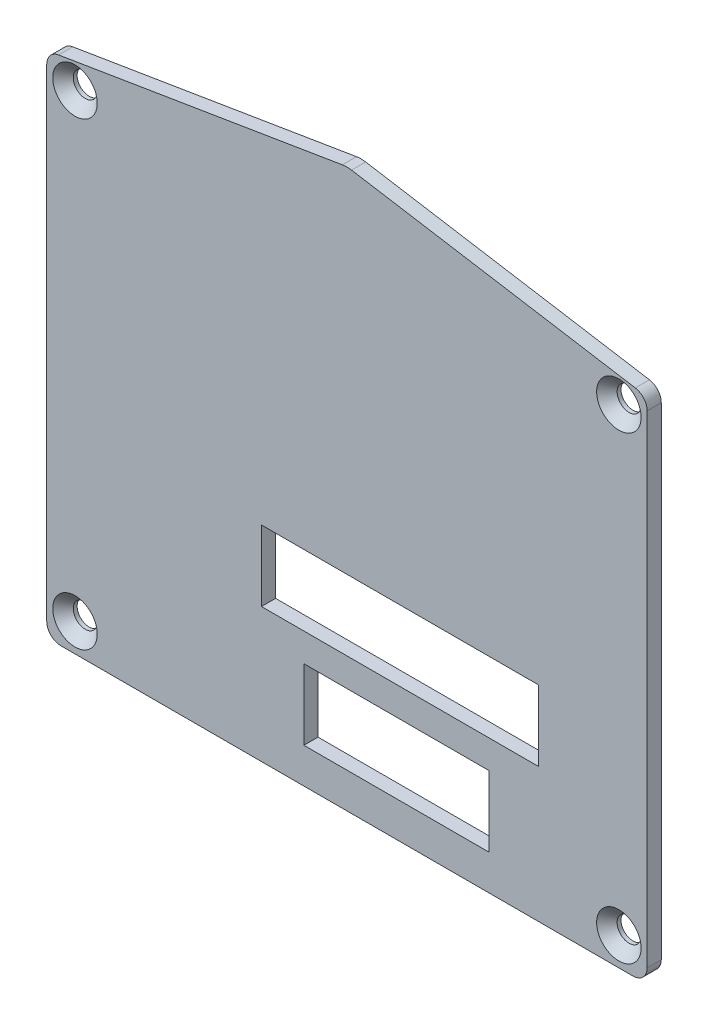
from build123d import *

# Parameters (mm, degrees)
SCHIZZO1_W                            = 85
SCHIZZO1_H                            = 72
ESTRUSIONE_ESTRUSIONE1_DEPTH          = 2
RACCORDO1_R                           = 4
RACCORDO3_R                           = 2
RACCORDO4_R                           = 2
RACCORDO5_R                           = 2
RACCORDO6_R                           = 2
TAGLIO_ESTRUSIONE1_REACH              = 62.453
SCHIZZO2_W                            = 39.2
SCHIZZO2_H                            = 10
SCHIZZO2_W_2                          = 26.2
FORO_SVASATO_PER_VITE_M3_1_AT_2_COUNT = 2
FORO_SVASATO_PER_VITE_M3_1_AT_2_PITCH = 65.075876997
FORO_SVASATO_PER_VITE_M3_1_AT_3_COUNT = 2
FORO_SVASATO_PER_VITE_M3_1_AT_3_PITCH = 100.816019396
FORO_SVASATO_PER_VITE_M3_1_AT_4_COUNT = 2
FORO_SVASATO_PER_VITE_M3_1_AT_4_PITCH = 77


with BuildPart() as part:
    # Schizzo1 → Estrusione-Estrusione1 (new body)
    with BuildSketch(Plane.XY):
        Rectangle(SCHIZZO1_W, SCHIZZO1_H)
        Polygon((0, 43), (42.5, 36), (-42.5, 36), align=None)
    extrude(amount=ESTRUSIONE_ESTRUSIONE1_DEPTH)

    # Raccordo1
    raccordo1_edges = [part.edges().sort_by_distance(p)[0] for p in [
        (0, 43, 1),
    ]]
    fillet(raccordo1_edges, radius=RACCORDO1_R)

    # Raccordo3
    raccordo3_edges = [part.edges().sort_by_distance(p)[0] for p in [
        (42.5, 36, 1),
    ]]
    fillet(raccordo3_edges, radius=RACCORDO3_R)

    # Raccordo4
    raccordo4_edges = [part.edges().sort_by_distance(p)[0] for p in [
        (42.5, -36, 1),
    ]]
    fillet(raccordo4_edges, radius=RACCORDO4_R)

    # Raccordo5
    raccordo5_edges = [part.edges().sort_by_distance(p)[0] for p in [
        (-42.5, -36, 1),
    ]]
    fillet(raccordo5_edges, radius=RACCORDO5_R)

    # Raccordo6
    raccordo6_edges = [part.edges().sort_by_distance(p)[0] for p in [
        (-42.5, 36, 1),
    ]]
    fillet(raccordo6_edges, radius=RACCORDO6_R)

    # Schizzo2 → Taglio-Estrusione1 (cut, up to next)
    with BuildSketch(Plane.XY.offset(2), mode=Mode.PRIVATE) as taglio_estrusione1_sk1:
        with Locations((7.5, -11.99)):
            Rectangle(SCHIZZO2_W, SCHIZZO2_H)
    taglio_estrusione1_tool1 = extrude(taglio_estrusione1_sk1.sketch, amount=-TAGLIO_ESTRUSIONE1_REACH, mode=Mode.PRIVATE) & part.part
    # Schizzo2 → Taglio-Estrusione1 (cut, up to next)
    with BuildSketch(Plane.XY.offset(2), mode=Mode.PRIVATE) as taglio_estrusione1_sk2:
        with Locations((7, -26)):
            Rectangle(SCHIZZO2_W_2, SCHIZZO2_H)
    taglio_estrusione1_tool2 = extrude(taglio_estrusione1_sk2.sketch, amount=-TAGLIO_ESTRUSIONE1_REACH, mode=Mode.PRIVATE) & part.part
    add(taglio_estrusione1_tool1.solids().sort_by_distance((7.5, -11.99, 2))[0], mode=Mode.SUBTRACT)
    add(taglio_estrusione1_tool2.solids().sort_by_distance((7, -26, 2))[0], mode=Mode.SUBTRACT)

    # Schizzo4 → Foro svasato per Vite M3-1 (revolve, cut)
    with BuildSketch(Plane(origin=(-38.5, 33.075876997, 2), x_dir=(0, -1, 0), z_dir=(1, 0, 0))):
        Polygon((0, 0), (0, 2), (1.7, 2), (1.7, 1.45), (3.15, 0), align=None)
    foro_svasato_per_vite_m3_1 = revolve(axis=Axis((-38.5, 33.075876997, 8.35), (0, 0, -1)), mode=Mode.SUBTRACT)

    # Foro svasato per Vite M3-1 at 2: Foro svasato per Vite M3-1 ×2
    with Locations(*[(0, -i * FORO_SVASATO_PER_VITE_M3_1_AT_2_PITCH, 0) for i in range(1, FORO_SVASATO_PER_VITE_M3_1_AT_2_COUNT)]):
        add(foro_svasato_per_vite_m3_1, mode=Mode.SUBTRACT)

    # Foro svasato per Vite M3-1 at 3: Foro svasato per Vite M3-1 ×2
    with Locations(*[Vector(0.7637675089853256, -0.6454914346591678, 0) * (i * FORO_SVASATO_PER_VITE_M3_1_AT_3_PITCH) for i in range(1, FORO_SVASATO_PER_VITE_M3_1_AT_3_COUNT)]):
        add(foro_svasato_per_vite_m3_1, mode=Mode.SUBTRACT)

    # Foro svasato per Vite M3-1 at 4: Foro svasato per Vite M3-1 ×2
    with Locations(*[(i * FORO_SVASATO_PER_VITE_M3_1_AT_4_PITCH, 0, 0) for i in range(1, FORO_SVASATO_PER_VITE_M3_1_AT_4_COUNT)]):
        add(foro_svasato_per_vite_m3_1, mode=Mode.SUBTRACT)


solid = part.part
